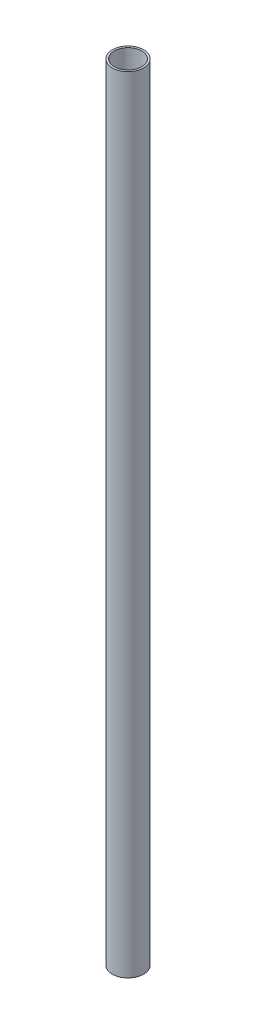
from build123d import *

# Parameters (mm, degrees)
SKETCH1_W          = 4
SKETCH1_H          = 200
SKETCH2_R          = 3.5
CUT_EXTRUDE1_DEPTH = 222.579061521
SKETCH3_R          = 1.5
CUT_EXTRUDE2_DEPTH = 22


with BuildPart() as part:
    # Sketch1 → Revolve1 (revolve)
    with BuildSketch(Plane.XY, mode=Mode.PRIVATE) as revolve1_sk:
        with Locations((-2, 105)):
            Rectangle(SKETCH1_W, SKETCH1_H)
    revolve(revolve1_sk.sketch.rotate(Axis((0, 5, 0), (0, 1, 0)), 270), axis=Axis((0, 5, 0), (0, 1, 0)))

    # Sketch2 → Cut-Extrude1 (cut)
    with BuildSketch(Plane(origin=(0, 205, 0), x_dir=(1, 0, 0), z_dir=(0, 1, 0))):
        with Locations(Location((0, 0, 0), (0, 0, 270))):
            Circle(SKETCH2_R)
    extrude(amount=-CUT_EXTRUDE1_DEPTH, mode=Mode.SUBTRACT)

    # Sketch3 → Cut-Extrude2 (cut)
    with BuildSketch(Plane(origin=(0, 0, 0), x_dir=(0, 0, -1), z_dir=(1, 0, 0))):
        with Locations((0, 27.7)):
            Circle(SKETCH3_R)
    extrude(amount=-CUT_EXTRUDE2_DEPTH, mode=Mode.SUBTRACT)


solid = part.part
